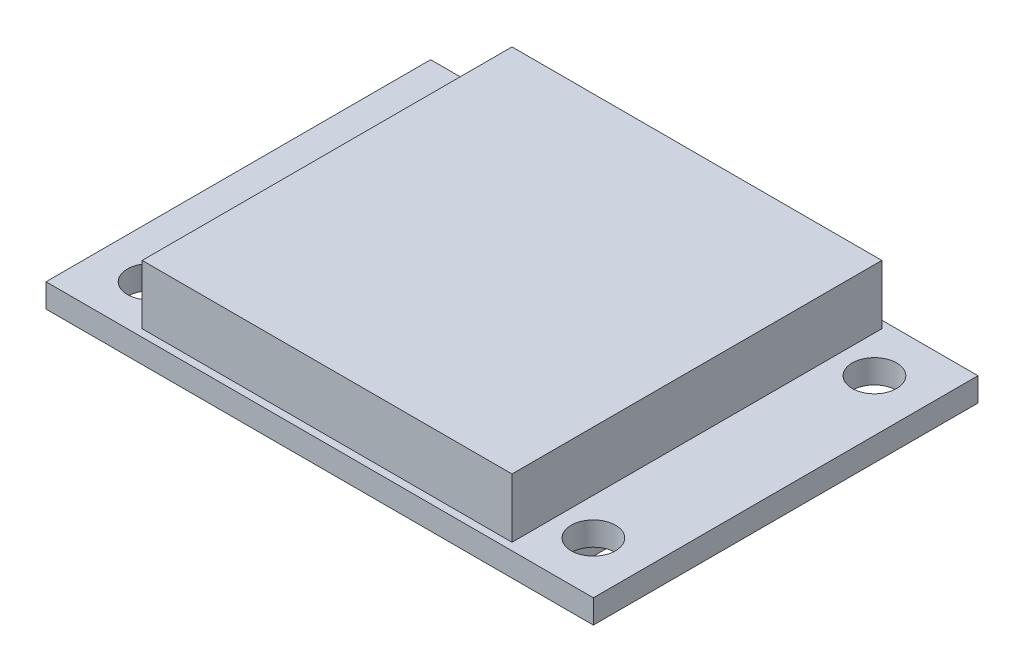
from build123d import *

# Parameters (mm, degrees)
SKETCH1_W           = 37
SKETCH1_H           = 26
SKETCH1_R           = 1.5
BOSS_EXTRUDE1_DEPTH = 1.6
SKETCH2_W           = 25
SKETCH2_H           = 25
BOSS_EXTRUDE2_DEPTH = 4
SKETCH3_W           = 12
SKETCH3_H           = 16
BOSS_EXTRUDE3_DEPTH = 2.4


with BuildPart() as part:
    # Sketch1 → Boss-Extrude1 (new body)
    with BuildSketch(Plane(origin=(0, 0, 0), x_dir=(1, 0, 0), z_dir=(0, 1, 0))):
        with Locations((18.5, 13)):
            Rectangle(SKETCH1_W, SKETCH1_H)
        with Locations(Location((3.5, 22.5, 0), (0, 0, 270))):
            Circle(SKETCH1_R, mode=Mode.SUBTRACT)
        with Locations(Location((33.5, 22.5, 0), (0, 0, 90))):
            Circle(SKETCH1_R, mode=Mode.SUBTRACT)
        with Locations(Location((33.5, 3.5, 0), (0, 0, 270))):
            Circle(SKETCH1_R, mode=Mode.SUBTRACT)
        with Locations(Location((3.5, 3.5, 0), (0, 0, 90))):
            Circle(SKETCH1_R, mode=Mode.SUBTRACT)
    extrude(amount=BOSS_EXTRUDE1_DEPTH)

    # Sketch2 → Boss-Extrude2 (add)
    with BuildSketch(Plane(origin=(0, 1.6, 0), x_dir=(1, 0, 0), z_dir=(0, 1, 0))):
        with Locations((18.5, 13)):
            Rectangle(SKETCH2_W, SKETCH2_H)
    extrude(amount=BOSS_EXTRUDE2_DEPTH)

    # Sketch3 → Boss-Extrude3 (add)
    with BuildSketch(Plane.XZ):
        with Locations((24.565846611, -13)):
            Rectangle(SKETCH3_W, SKETCH3_H)
    extrude(amount=BOSS_EXTRUDE3_DEPTH)


solid = part.part
